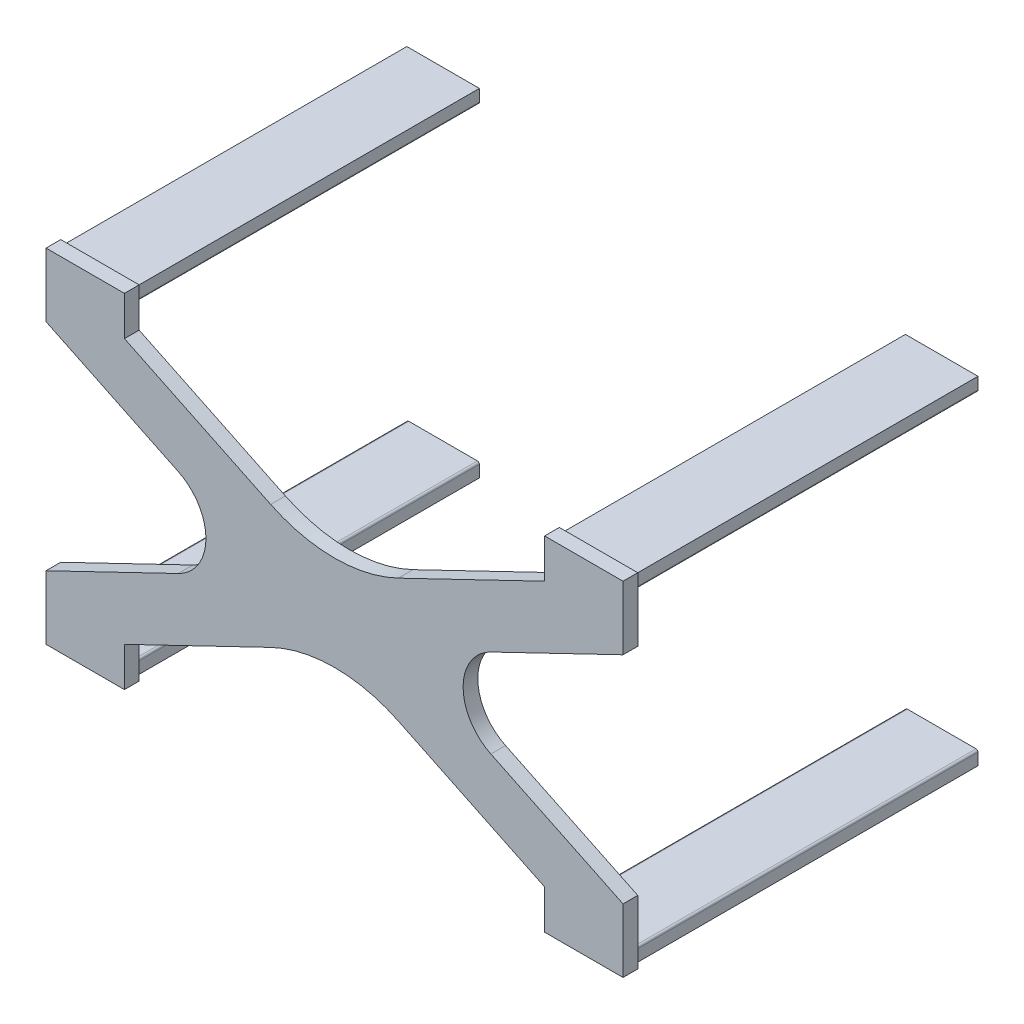
from build123d import *

# Parameters (mm, degrees)
EXTRUDE_1_DEPTH = 3
FILLET_1_R      = 30
FILLET_2_R      = 10
EXTRUDE_2_DEPTH = 70


with BuildPart() as part:
    # Эскиз1 → Бобышка-Вытянуть1 (new body)
    with BuildSketch(Plane.XY):
        with BuildLine():
            ThreePointArc((-57.85, 31), (-58.557106781, 31.292893219), (-58.85, 32))
            Line((-58.85, 32), (-58.85, 22))
            Line((-58.85, 22), (-13.18877551, 0))
            Line((-13.18877551, 0), (0, 6.354473943))
            Line((0, 6.354473943), (-42.85, 27))
            Line((-42.85, 27), (-42.85, 32))
            ThreePointArc((-42.85, 32), (-43.142893219, 31.292893219), (-43.85, 31))
            Line((-43.85, 31), (-57.85, 31))
        make_face()
        with BuildLine():
            Line((42.85, 27), (0, 6.354473943))
            Line((0, 6.354473943), (13.18877551, 0))
            Line((13.18877551, 0), (58.85, 22))
            Line((58.85, 22), (58.85, 32))
            ThreePointArc((58.85, 32), (58.557106781, 31.292893219), (57.85, 31))
            Line((57.85, 31), (43.85, 31))
            ThreePointArc((43.85, 31), (43.142893219, 31.292893219), (42.85, 32))
            Line((42.85, 32), (42.85, 27))
        make_face()
        with BuildLine():
            Line((-58.85, -22), (-58.85, -32))
            ThreePointArc((-58.85, -32), (-58.557106781, -31.292893219), (-57.85, -31))
            Line((-57.85, -31), (-43.85, -31))
            ThreePointArc((-43.85, -31), (-43.142893219, -31.292893219), (-42.85, -32))
            Line((-42.85, -32), (-42.85, -27))
            Line((-42.85, -27), (0, -6.354473943))
            Line((0, -6.354473943), (-13.18877551, 0))
            Line((-13.18877551, 0), (-58.85, -22))
        make_face()
        with BuildLine():
            Line((42.85, -27), (42.85, -32))
            ThreePointArc((42.85, -32), (43.142893219, -31.292893219), (43.85, -31))
            Line((43.85, -31), (57.85, -31))
            ThreePointArc((57.85, -31), (58.557106781, -31.292893219), (58.85, -32))
            Line((58.85, -32), (58.85, -22))
            Line((58.85, -22), (13.18877551, 0))
            Line((13.18877551, 0), (0, -6.354473943))
            Line((0, -6.354473943), (42.85, -27))
        make_face()
        Polygon((0, 6.354473943), (-13.18877551, 0), (0, -6.354473943), (13.18877551, 0), align=None)
        with BuildLine():
            Line((-42.85, 35), (-58.85, 35))
            Line((-58.85, 35), (-58.85, 32))
            ThreePointArc((-58.85, 32), (-58.557106781, 31.292893219), (-57.85, 31))
            Line((-57.85, 31), (-43.85, 31))
            ThreePointArc((-43.85, 31), (-43.142893219, 31.292893219), (-42.85, 32))
            Line((-42.85, 32), (-42.85, 35))
        make_face()
        with BuildLine():
            Line((-58.85, -32), (-58.85, -35))
            Line((-58.85, -35), (-42.85, -35))
            Line((-42.85, -35), (-42.85, -32))
            ThreePointArc((-42.85, -32), (-43.142893219, -31.292893219), (-43.85, -31))
            Line((-43.85, -31), (-57.85, -31))
            ThreePointArc((-57.85, -31), (-58.557106781, -31.292893219), (-58.85, -32))
        make_face()
        with BuildLine():
            Line((42.85, -32), (42.85, -35))
            Line((42.85, -35), (58.85, -35))
            Line((58.85, -35), (58.85, -32))
            ThreePointArc((58.85, -32), (58.557106781, -31.292893219), (57.85, -31))
            Line((57.85, -31), (43.85, -31))
            ThreePointArc((43.85, -31), (43.142893219, -31.292893219), (42.85, -32))
        make_face()
        with BuildLine():
            Line((58.85, 35), (42.85, 35))
            Line((42.85, 35), (42.85, 32))
            ThreePointArc((42.85, 32), (43.142893219, 31.292893219), (43.85, 31))
            Line((43.85, 31), (57.85, 31))
            ThreePointArc((57.85, 31), (58.557106781, 31.292893219), (58.85, 32))
            Line((58.85, 32), (58.85, 35))
        make_face()
    extrude(amount=EXTRUDE_1_DEPTH)

    # Скругление1
    fillet_1_edges = [part.edges().sort_by_distance(p)[0] for p in [
        (0, -6.354473943, 1.5),
        (0, 6.354473943, 1.5),
    ]]
    fillet(fillet_1_edges, radius=FILLET_1_R)

    # Скругление2
    fillet_2_edges = [part.edges().sort_by_distance(p)[0] for p in [
        (-13.18877551, 0, 1.5),
        (13.18877551, 0, 1.5),
    ]]
    fillet(fillet_2_edges, radius=FILLET_2_R)


with BuildPart() as body_2:
    # Эскиз2 → Бобышка-Вытянуть2 (new body)
    with BuildSketch(Plane(origin=(0, 0, 0), x_dir=(-1, 0, 0), z_dir=(0, 0, -1))):
        with BuildLine():
            Line((-50.85, 34.4), (-58.25, 34.4))
            Line((-58.25, 34.4), (-58.25, 32))
            ThreePointArc((-58.25, 32), (-58.132842712, 31.717157288), (-57.85, 31.6))
            Line((-57.85, 31.6), (-50.85, 31.6))
            Line((-50.85, 31.6), (-50.85, 34.4))
        make_face()
        with BuildLine():
            Line((-43.45, 34.4), (-50.85, 34.4))
            Line((-50.85, 34.4), (-50.85, 31.6))
            Line((-50.85, 31.6), (-43.85, 31.6))
            ThreePointArc((-43.85, 31.6), (-43.567157288, 31.717157288), (-43.45, 32))
            Line((-43.45, 32), (-43.45, 34.4))
        make_face()
        with BuildLine():
            Line((-57.85, -31.6), (-43.85, -31.6))
            ThreePointArc((-43.85, -31.6), (-43.567157288, -31.717157288), (-43.45, -32))
            Line((-43.45, -32), (-43.45, -34.4))
            Line((-43.45, -34.4), (-58.25, -34.4))
            Line((-58.25, -34.4), (-58.25, -32))
            ThreePointArc((-58.25, -32), (-58.132842712, -31.717157288), (-57.85, -31.6))
        make_face()
        with BuildLine():
            Line((57.85, -31.6), (43.85, -31.6))
            ThreePointArc((43.85, -31.6), (43.567157288, -31.717157288), (43.45, -32))
            Line((43.45, -32), (43.45, -34.4))
            Line((43.45, -34.4), (58.25, -34.4))
            Line((58.25, -34.4), (58.25, -32))
            ThreePointArc((58.25, -32), (58.132842712, -31.717157288), (57.85, -31.6))
        make_face()
        with BuildLine():
            Line((43.45, 32), (43.45, 34.4))
            Line((43.45, 34.4), (58.25, 34.4))
            Line((58.25, 34.4), (58.25, 32))
            ThreePointArc((58.25, 32), (58.132842712, 31.717157288), (57.85, 31.6))
            Line((57.85, 31.6), (43.85, 31.6))
            ThreePointArc((43.85, 31.6), (43.567157288, 31.717157288), (43.45, 32))
        make_face()
    extrude(amount=EXTRUDE_2_DEPTH)


solid = Compound([part.part, body_2.part])
